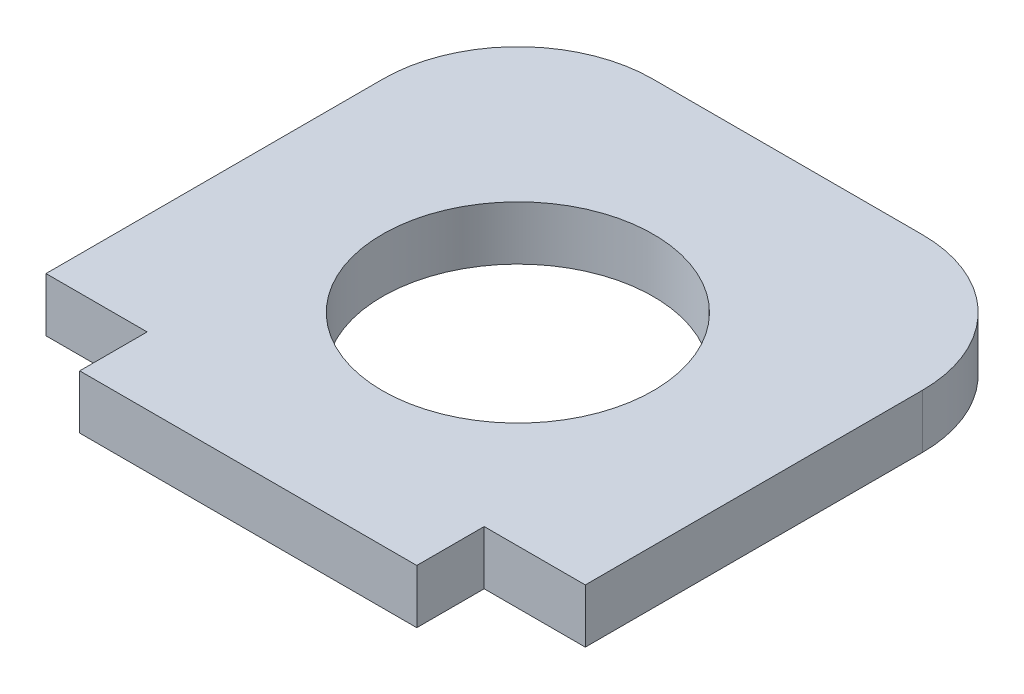
from build123d import *

# Parameters (mm, degrees)
EXTRUDE_1_DEPTH     = 4
SKETCH_5_R          = 10.05
CUT_EXTRUDE_4_DEPTH = 29.565713714
FILLET_1_R          = 10


with BuildPart() as part:
    # Эскиз1 → Бобышка-Вытянуть1 (new body)
    with BuildSketch(Plane(origin=(0, 0, 0), x_dir=(1, 0, 0), z_dir=(0, 1, 0))):
        Polygon((-20, -15), (-12.5, -15), (-12.5, -20), (12.5, -20), (12.5, -15), (20, -15), (20, 20), (-20, 20), align=None)
    extrude(amount=EXTRUDE_1_DEPTH)

    # Эскиз5 → Вырез-Вытянуть4 (cut, through all)
    with BuildSketch(Plane(origin=(0, 4, 0), x_dir=(1, 0, 0), z_dir=(0, 1, 0))):
        with Locations(Location((0, 0, 0), (0, 0, 270))):
            Circle(SKETCH_5_R)
    extrude(amount=-CUT_EXTRUDE_4_DEPTH, mode=Mode.SUBTRACT)

    # Скругление1
    fillet_1_edges = [part.edges().sort_by_distance(p)[0] for p in [
        (-20, 2, -20),
        (20, 2, -20),
    ]]
    fillet(fillet_1_edges, radius=FILLET_1_R)


solid = part.part
